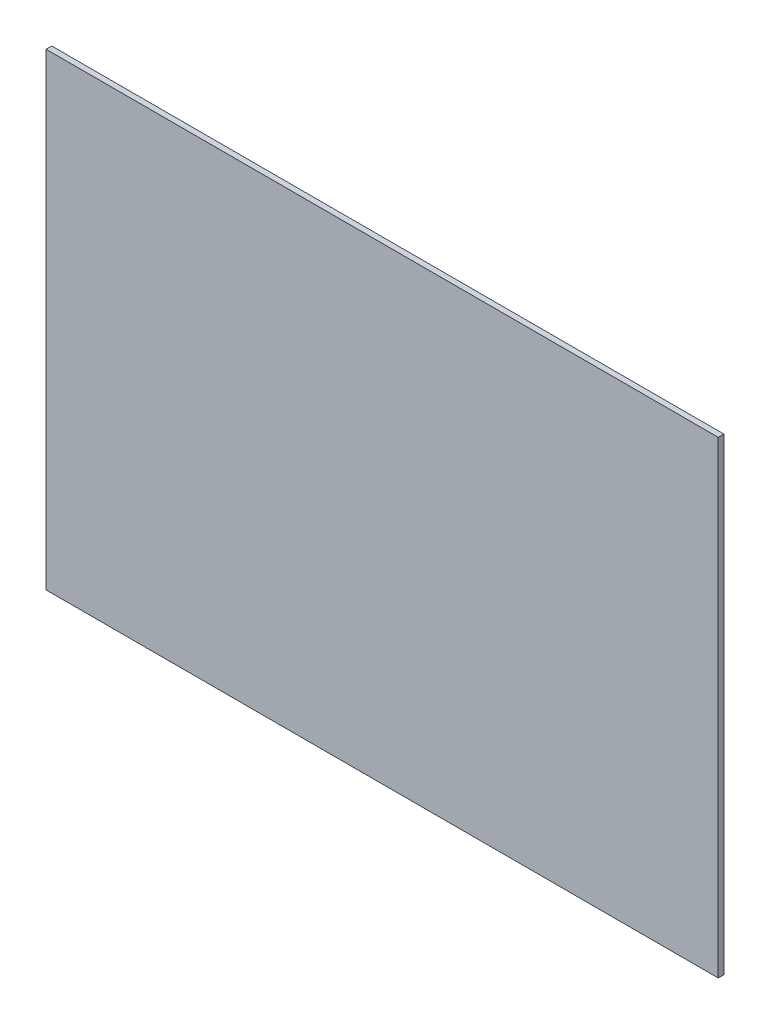
from build123d import *

# Parameters (mm, degrees)
ESQUISSE1_W        = 356
ESQUISSE1_H        = 248
BOSS_EXTRU_1_DEPTH = 3


with BuildPart() as part:
    # Esquisse1 → Boss.-Extru.1 (new body)
    with BuildSketch(Plane.XY):
        with Locations((9.753424658, -37.438356164)):
            Rectangle(ESQUISSE1_W, ESQUISSE1_H)
    extrude(amount=BOSS_EXTRU_1_DEPTH)


solid = part.part
